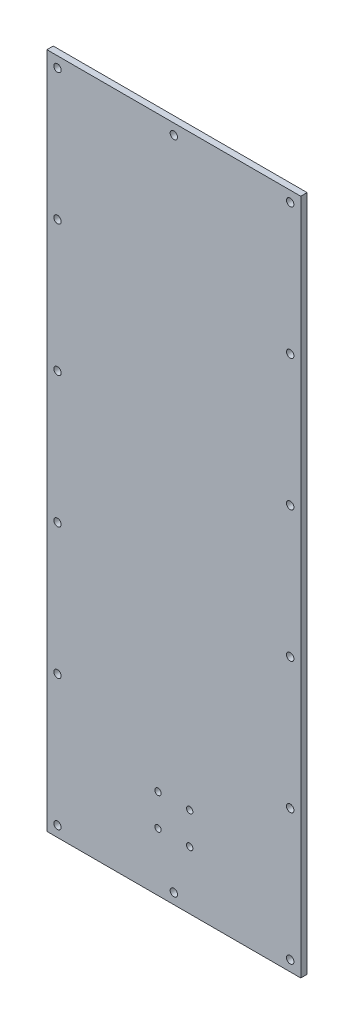
from build123d import *

# Parameters (mm, degrees)
ESQUISSE1_W             = 120
ESQUISSE1_H             = 320
BOSS_EXTRU_1_DEPTH      = 3
ESQUISSE2_R             = 1.747592995
ESQUISSE2_R_2           = 1.5
ENL_V_MAT_EXTRU_1_DEPTH = 10


with BuildPart() as part:
    # Esquisse1 → Boss.-Extru.1 (new body)
    with BuildSketch(Plane.XY):
        Rectangle(ESQUISSE1_W, ESQUISSE1_H)
    extrude(amount=BOSS_EXTRU_1_DEPTH)

    # Esquisse2 → Enlèv. mat.-Extru.1 (cut)
    with BuildSketch(Plane.XY.offset(3)):
        with Locations((-55, 155)):
            Circle(ESQUISSE2_R)
        with Locations((0, 155)):
            Circle(ESQUISSE2_R)
        with Locations((55, 155)):
            Circle(ESQUISSE2_R)
        with Locations((-55, 93)):
            Circle(ESQUISSE2_R)
        with Locations((-55, 31)):
            Circle(ESQUISSE2_R)
        with Locations((-55, -31)):
            Circle(ESQUISSE2_R)
        with Locations((-55, -93)):
            Circle(ESQUISSE2_R)
        with Locations((-55, -155)):
            Circle(ESQUISSE2_R)
        with Locations((0, -155)):
            Circle(ESQUISSE2_R)
        with Locations((55, -155)):
            Circle(ESQUISSE2_R)
        with Locations((55, 93)):
            Circle(ESQUISSE2_R)
        with Locations((55, 31)):
            Circle(ESQUISSE2_R)
        with Locations((55, -31)):
            Circle(ESQUISSE2_R)
        with Locations((55, -93)):
            Circle(ESQUISSE2_R)
        with Locations((-7.5, -117.5)):
            Circle(ESQUISSE2_R_2)
        with Locations((7.5, -117.5)):
            Circle(ESQUISSE2_R_2)
        with Locations((7.5, -132.5)):
            Circle(ESQUISSE2_R_2)
        with Locations((-7.5, -132.5)):
            Circle(ESQUISSE2_R_2)
    extrude(amount=-ENL_V_MAT_EXTRU_1_DEPTH, mode=Mode.SUBTRACT)


solid = part.part
